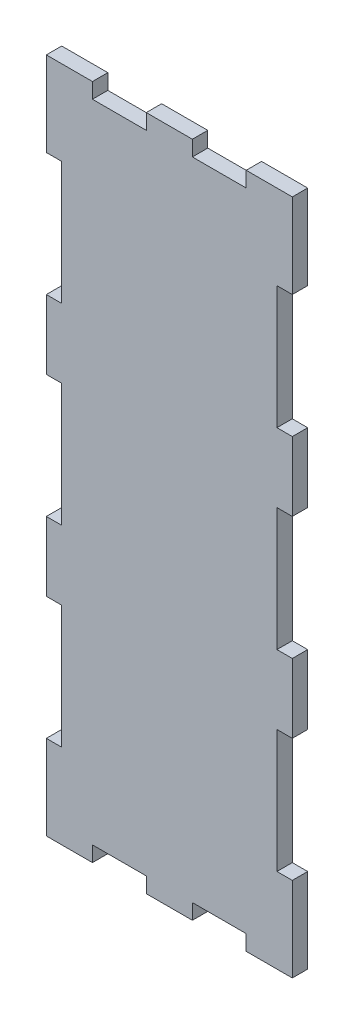
from build123d import *

# Parameters (mm, degrees)
SKETCH1_W               = 56
SKETCH1_H               = 4
BOSS_EXTRUDE1_DEPTH     = 168
SKETCH2_W               = 4
SKETCH2_H               = 18
BOSS_EXTRUDE3_DEPTH     = 4
LPATTERN1_COUNT         = 4
LPATTERN1_PITCH         = 50
MIRROR1_COPY_1_SKETCH_W = 4
MIRROR1_COPY_1_SKETCH_H = 18
MIRROR1_COPY_1_DEPTH    = 4
MIRROR1_COPY_2_SKETCH_W = 4
MIRROR1_COPY_2_SKETCH_H = 18
MIRROR1_COPY_2_DEPTH    = 4
MIRROR1_COPY_3_SKETCH_W = 4
MIRROR1_COPY_3_SKETCH_H = 18
MIRROR1_COPY_3_DEPTH    = 4
SKETCH3_W               = 12
SKETCH3_H               = 4
BOSS_EXTRUDE4_DEPTH     = 4


with BuildPart() as part:
    # Sketch1 → Boss-Extrude1 (new body)
    with BuildSketch(Plane(origin=(0, 0, 0), x_dir=(1, 0, 0), z_dir=(0, 1, 0))):
        Rectangle(SKETCH1_W, SKETCH1_H)
    extrude(amount=BOSS_EXTRUDE1_DEPTH)

    # Sketch2 → Boss-Extrude3 (add, through all)
    with BuildSketch(Plane.XY.offset(2)):
        with Locations((-30, 9)):
            Rectangle(SKETCH2_W, SKETCH2_H)
    boss_extrude3 = extrude(amount=-BOSS_EXTRUDE3_DEPTH)

    # LPattern1: Boss-Extrude3 ×4
    with Locations(*[(0, i * LPATTERN1_PITCH, 0) for i in range(1, LPATTERN1_COUNT)]):
        add(boss_extrude3)

    # Mirror1: Boss-Extrude3 across plane
    add(boss_extrude3.mirror(Plane(origin=(0, 0, 0), x_dir=(0, 0, 1), z_dir=(1, 0, 0))))

    # Mirror1 copy 1 sketch → Mirror1 copy 1 (add, through all)
    with BuildSketch(Plane(origin=(0, 50, 2), x_dir=(-1, 0, 0), z_dir=(0, 0, 1))):
        with Locations((-30, -9)):
            Rectangle(MIRROR1_COPY_1_SKETCH_W, MIRROR1_COPY_1_SKETCH_H)
    extrude(amount=-MIRROR1_COPY_1_DEPTH)

    # Mirror1 copy 2 sketch → Mirror1 copy 2 (add, through all)
    with BuildSketch(Plane(origin=(0, 100, 2), x_dir=(-1, 0, 0), z_dir=(0, 0, 1))):
        with Locations((-30, -9)):
            Rectangle(MIRROR1_COPY_2_SKETCH_W, MIRROR1_COPY_2_SKETCH_H)
    extrude(amount=-MIRROR1_COPY_2_DEPTH)

    # Mirror1 copy 3 sketch → Mirror1 copy 3 (add, through all)
    with BuildSketch(Plane(origin=(0, 150, 2), x_dir=(-1, 0, 0), z_dir=(0, 0, 1))):
        with Locations((-30, -9)):
            Rectangle(MIRROR1_COPY_3_SKETCH_W, MIRROR1_COPY_3_SKETCH_H)
    extrude(amount=-MIRROR1_COPY_3_DEPTH)

    # Sketch3 → Boss-Extrude4 (add, through all)
    with BuildSketch(Plane(origin=(0, 0, -2), x_dir=(-1, 0, 0), z_dir=(0, 0, -1))):
        with Locations((26, -2)):
            Rectangle(SKETCH3_W, SKETCH3_H)
        with Locations((0, -2)):
            Rectangle(SKETCH3_W, SKETCH3_H)
        with Locations((-26, -2)):
            Rectangle(SKETCH3_W, SKETCH3_H)
    boss_extrude4 = extrude(amount=-BOSS_EXTRUDE4_DEPTH)

    # Mirror2: Boss-Extrude4 across plane
    add(boss_extrude4.mirror(Plane(origin=(0, 84, 0), x_dir=(0, 0, 1), z_dir=(0, -1, 0))))


solid = part.part
